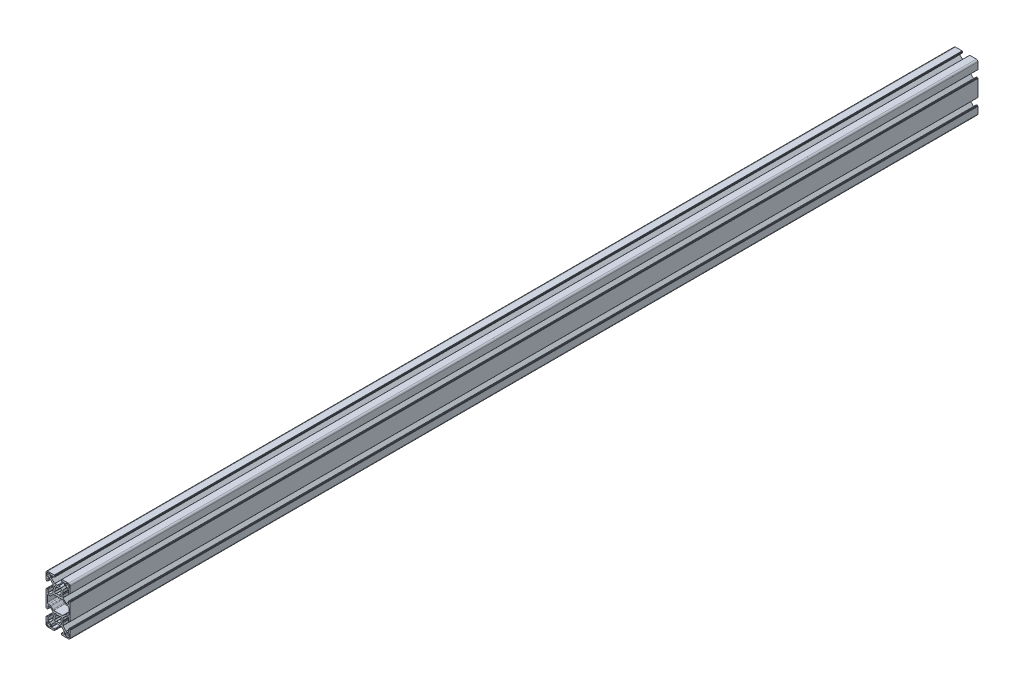
from build123d import *

# Parameters (mm, degrees)
EXTRUDE1_DEPTH = 1128.95


with BuildPart() as part:
    # Sketch1 → Extrude1 (new body)
    with BuildSketch(Plane.XY):
        with BuildLine():
            Line((4.117156145, -21), (0.899999648, -21))
            Line((0.899999648, -21), (0.101934004, -20.53923672))
            ThreePointArc((0.101934004, -20.53923672), (0, -20.511923593), (-0.101934004, -20.53923672))
            Line((-0.101934004, -20.53923672), (-0.899999648, -21))
            Line((-0.899999648, -21), (-4.117156145, -21))
            ThreePointArc((-4.117156145, -21), (-4.193692724, -21.015224069), (-4.258577305, -21.058578552))
            Line((-4.258577305, -21.058578552), (-8.191421308, -24.991421554))
            ThreePointArc((-8.191421308, -24.991421554), (-8.234775894, -25.056306263), (-8.25, -25.132843))
            Line((-8.25, -25.132843), (-8.25, -27.6))
            ThreePointArc((-8.25, -27.6), (-8.191421356, -27.741421356), (-8.05, -27.8))
            Line((-8.05, -27.8), (-4.65, -27.8))
            ThreePointArc((-4.65, -27.8), (-4.225735931, -27.975735931), (-4.05, -28.4))
            Line((-4.05, -28.4), (-4.05, -29.3))
            ThreePointArc((-4.05, -29.3), (-4.108578644, -29.441421356), (-4.25, -29.5))
            Line((-4.25, -29.5), (-4.35, -29.5))
            ThreePointArc((-4.35, -29.5), (-4.491421356, -29.558578644), (-4.55, -29.7))
            Line((-4.55, -29.7), (-4.55, -29.8))
            ThreePointArc((-4.55, -29.8), (-4.608578644, -29.941421356), (-4.75, -30))
            Line((-4.75, -30), (-13, -30))
            ThreePointArc((-13, -30), (-14.414213562, -29.414213562), (-15, -28))
            Line((-15, -28), (-15, -19.750000125))
            ThreePointArc((-15, -19.750000125), (-14.941421356, -19.608578769), (-14.8, -19.550000125))
            Line((-14.8, -19.550000125), (-14.700000334, -19.550000125))
            ThreePointArc((-14.700000334, -19.550000125), (-14.558578978, -19.491421481), (-14.500000334, -19.350000125))
            Line((-14.500000334, -19.350000125), (-14.500000334, -19.25))
            ThreePointArc((-14.500000334, -19.25), (-14.44142169, -19.108578644), (-14.300000334, -19.05))
            Line((-14.300000334, -19.05), (-13.400000821, -19.05))
            ThreePointArc((-13.400000821, -19.05), (-12.975736752, -19.225735931), (-12.800000821, -19.65))
            Line((-12.800000821, -19.65), (-12.800000821, -23.05))
            ThreePointArc((-12.800000821, -23.05), (-12.741422177, -23.191421356), (-12.600000821, -23.25))
            Line((-12.600000821, -23.25), (-10.132842821, -23.25))
            ThreePointArc((-10.132842821, -23.25), (-10.056306123, -23.234775902), (-9.991421447, -23.191421338))
            Line((-9.991421447, -23.191421338), (-6.063045884, -19.263044775))
            ThreePointArc((-6.063045884, -19.263044775), (-6.019691347, -19.198160112), (-6.004467258, -19.121623437))
            Line((-6.004467258, -19.121623437), (-6.004467258, -15.90000009))
            Line((-6.004467258, -15.90000009), (-5.542586948, -15.099999736))
            ThreePointArc((-5.542586948, -15.099999736), (-5.515792105, -15), (-5.542586948, -14.900000264))
            Line((-5.542586948, -14.900000264), (-6.004467258, -14.09999991))
            Line((-6.004467258, -14.09999991), (-6.004467258, -10.878376563))
            ThreePointArc((-6.004467258, -10.878376563), (-6.019691347, -10.801839888), (-6.063045884, -10.736955225))
            Line((-6.063045884, -10.736955225), (-9.991421447, -6.808578662))
            ThreePointArc((-9.991421447, -6.808578662), (-10.056306123, -6.765224098), (-10.132842821, -6.75))
            Line((-10.132842821, -6.75), (-12.600000821, -6.75))
            ThreePointArc((-12.600000821, -6.75), (-12.741422177, -6.808578644), (-12.800000821, -6.95))
            Line((-12.800000821, -6.95), (-12.800000821, -10.35))
            ThreePointArc((-12.800000821, -10.35), (-12.975736752, -10.774264069), (-13.400000821, -10.95))
            Line((-13.400000821, -10.95), (-14.300000334, -10.95))
            ThreePointArc((-14.300000334, -10.95), (-14.44142169, -10.891421356), (-14.500000334, -10.75))
            Line((-14.500000334, -10.75), (-14.500000334, -10.65))
            ThreePointArc((-14.500000334, -10.65), (-14.558578978, -10.508578644), (-14.700000334, -10.45))
            Line((-14.700000334, -10.45), (-14.8, -10.45))
            ThreePointArc((-14.8, -10.45), (-14.941421356, -10.391421356), (-15, -10.25))
            Line((-15, -10.25), (-15, 10.25))
            ThreePointArc((-15, 10.25), (-14.941421356, 10.391421356), (-14.8, 10.45))
            Line((-14.8, 10.45), (-14.700000334, 10.45))
            ThreePointArc((-14.700000334, 10.45), (-14.558578978, 10.508578644), (-14.500000334, 10.65))
            Line((-14.500000334, 10.65), (-14.500000334, 10.75))
            ThreePointArc((-14.500000334, 10.75), (-14.44142169, 10.891421356), (-14.300000334, 10.95))
            Line((-14.300000334, 10.95), (-13.400000821, 10.95))
            ThreePointArc((-13.400000821, 10.95), (-12.975736752, 10.774264069), (-12.800000821, 10.35))
            Line((-12.800000821, 10.35), (-12.800000821, 6.95))
            ThreePointArc((-12.800000821, 6.95), (-12.741422177, 6.808578644), (-12.600000821, 6.75))
            Line((-12.600000821, 6.75), (-10.132842821, 6.75))
            ThreePointArc((-10.132842821, 6.75), (-10.056306123, 6.765224098), (-9.991421447, 6.808578662))
            Line((-9.991421447, 6.808578662), (-6.063045884, 10.736955225))
            ThreePointArc((-6.063045884, 10.736955225), (-6.019691347, 10.801839888), (-6.004467258, 10.878376563))
            Line((-6.004467258, 10.878376563), (-6.004467258, 14.09999991))
            Line((-6.004467258, 14.09999991), (-5.542586948, 14.900000264))
            ThreePointArc((-5.542586948, 14.900000264), (-5.515792105, 15), (-5.542586948, 15.099999736))
            Line((-5.542586948, 15.099999736), (-6.004467258, 15.90000009))
            Line((-6.004467258, 15.90000009), (-6.004467258, 19.121623437))
            ThreePointArc((-6.004467258, 19.121623437), (-6.019691347, 19.198160112), (-6.063045884, 19.263044775))
            Line((-6.063045884, 19.263044775), (-9.991421447, 23.191421338))
            ThreePointArc((-9.991421447, 23.191421338), (-10.056306123, 23.234775902), (-10.132842821, 23.25))
            Line((-10.132842821, 23.25), (-12.600000821, 23.25))
            ThreePointArc((-12.600000821, 23.25), (-12.741422177, 23.191421356), (-12.800000821, 23.05))
            Line((-12.800000821, 23.05), (-12.800000821, 19.65))
            ThreePointArc((-12.800000821, 19.65), (-12.975736752, 19.225735931), (-13.400000821, 19.05))
            Line((-13.400000821, 19.05), (-14.300000334, 19.05))
            ThreePointArc((-14.300000334, 19.05), (-14.44142169, 19.108578644), (-14.500000334, 19.25))
            Line((-14.500000334, 19.25), (-14.500000334, 19.350000125))
            ThreePointArc((-14.500000334, 19.350000125), (-14.558578978, 19.491421481), (-14.700000334, 19.550000125))
            Line((-14.700000334, 19.550000125), (-14.8, 19.550000125))
            ThreePointArc((-14.8, 19.550000125), (-14.941421356, 19.608578769), (-15, 19.750000125))
            Line((-15, 19.750000125), (-15, 28))
            ThreePointArc((-15, 28), (-14.414213562, 29.414213562), (-13, 30))
            Line((-13, 30), (-4.75, 30))
            ThreePointArc((-4.75, 30), (-4.608578644, 29.941421356), (-4.55, 29.8))
            Line((-4.55, 29.8), (-4.55, 29.7))
            ThreePointArc((-4.55, 29.7), (-4.491421356, 29.558578644), (-4.35, 29.5))
            Line((-4.35, 29.5), (-4.25, 29.5))
            ThreePointArc((-4.25, 29.5), (-4.108578644, 29.441421356), (-4.05, 29.3))
            Line((-4.05, 29.3), (-4.05, 28.4))
            ThreePointArc((-4.05, 28.4), (-4.225735931, 27.975735931), (-4.65, 27.8))
            Line((-4.65, 27.8), (-8.05, 27.8))
            ThreePointArc((-8.05, 27.8), (-8.191421356, 27.741421356), (-8.25, 27.6))
            Line((-8.25, 27.6), (-8.25, 25.132843))
            ThreePointArc((-8.25, 25.132843), (-8.234775894, 25.056306263), (-8.191421308, 24.991421554))
            Line((-8.191421308, 24.991421554), (-4.258577305, 21.058578552))
            ThreePointArc((-4.258577305, 21.058578552), (-4.193692724, 21.015224069), (-4.117156145, 21))
            Line((-4.117156145, 21), (-0.899999648, 21))
            Line((-0.899999648, 21), (-0.101934004, 20.53923672))
            ThreePointArc((-0.101934004, 20.53923672), (0, 20.511923593), (0.101934004, 20.53923672))
            Line((0.101934004, 20.53923672), (0.899999648, 21))
            Line((0.899999648, 21), (4.117156145, 21))
            ThreePointArc((4.117156145, 21), (4.193692724, 21.015224069), (4.258577305, 21.058578552))
            Line((4.258577305, 21.058578552), (8.191421308, 24.991421554))
            ThreePointArc((8.191421308, 24.991421554), (8.234775894, 25.056306263), (8.25, 25.132843))
            Line((8.25, 25.132843), (8.25, 27.6))
            ThreePointArc((8.25, 27.6), (8.191421356, 27.741421356), (8.05, 27.8))
            Line((8.05, 27.8), (4.65, 27.8))
            ThreePointArc((4.65, 27.8), (4.225735931, 27.975735931), (4.05, 28.4))
            Line((4.05, 28.4), (4.05, 29.3))
            ThreePointArc((4.05, 29.3), (4.108578644, 29.441421356), (4.25, 29.5))
            Line((4.25, 29.5), (4.35, 29.5))
            ThreePointArc((4.35, 29.5), (4.491421356, 29.558578644), (4.55, 29.7))
            Line((4.55, 29.7), (4.55, 29.8))
            ThreePointArc((4.55, 29.8), (4.608578644, 29.941421356), (4.75, 30))
            Line((4.75, 30), (13, 30))
            ThreePointArc((13, 30), (14.414213562, 29.414213562), (15, 28))
            Line((15, 28), (15, 19.750000125))
            ThreePointArc((15, 19.750000125), (14.941421356, 19.608578769), (14.8, 19.550000125))
            Line((14.8, 19.550000125), (14.700000334, 19.550000125))
            ThreePointArc((14.700000334, 19.550000125), (14.558578978, 19.491421481), (14.500000334, 19.350000125))
            Line((14.500000334, 19.350000125), (14.500000334, 19.25))
            ThreePointArc((14.500000334, 19.25), (14.44142169, 19.108578644), (14.300000334, 19.05))
            Line((14.300000334, 19.05), (13.400000821, 19.05))
            ThreePointArc((13.400000821, 19.05), (12.975736752, 19.225735931), (12.800000821, 19.65))
            Line((12.800000821, 19.65), (12.800000821, 23.05))
            ThreePointArc((12.800000821, 23.05), (12.741422177, 23.191421356), (12.600000821, 23.25))
            Line((12.600000821, 23.25), (10.132842821, 23.25))
            ThreePointArc((10.132842821, 23.25), (10.056306123, 23.234775902), (9.991421447, 23.191421338))
            Line((9.991421447, 23.191421338), (6.063045884, 19.263044775))
            ThreePointArc((6.063045884, 19.263044775), (6.019691347, 19.198160112), (6.004467258, 19.121623437))
            Line((6.004467258, 19.121623437), (6.004467258, 15.90000009))
            Line((6.004467258, 15.90000009), (5.542586948, 15.099999736))
            ThreePointArc((5.542586948, 15.099999736), (5.515792105, 15), (5.542586948, 14.900000264))
            Line((5.542586948, 14.900000264), (6.004467258, 14.09999991))
            Line((6.004467258, 14.09999991), (6.004467258, 10.878376563))
            ThreePointArc((6.004467258, 10.878376563), (6.019691347, 10.801839888), (6.063045884, 10.736955225))
            Line((6.063045884, 10.736955225), (9.991421447, 6.808578662))
            ThreePointArc((9.991421447, 6.808578662), (10.056306123, 6.765224098), (10.132842821, 6.75))
            Line((10.132842821, 6.75), (12.600000821, 6.75))
            ThreePointArc((12.600000821, 6.75), (12.741422177, 6.808578644), (12.800000821, 6.95))
            Line((12.800000821, 6.95), (12.800000821, 10.35))
            ThreePointArc((12.800000821, 10.35), (12.975736752, 10.774264069), (13.400000821, 10.95))
            Line((13.400000821, 10.95), (14.300000334, 10.95))
            ThreePointArc((14.300000334, 10.95), (14.44142169, 10.891421356), (14.500000334, 10.75))
            Line((14.500000334, 10.75), (14.500000334, 10.65))
            ThreePointArc((14.500000334, 10.65), (14.558578978, 10.508578644), (14.700000334, 10.45))
            Line((14.700000334, 10.45), (14.8, 10.45))
            ThreePointArc((14.8, 10.45), (14.941421356, 10.391421356), (15, 10.25))
            Line((15, 10.25), (15, -10.25))
            ThreePointArc((15, -10.25), (14.941421356, -10.391421356), (14.8, -10.45))
            Line((14.8, -10.45), (14.700000334, -10.45))
            ThreePointArc((14.700000334, -10.45), (14.558578978, -10.508578644), (14.500000334, -10.65))
            Line((14.500000334, -10.65), (14.500000334, -10.75))
            ThreePointArc((14.500000334, -10.75), (14.44142169, -10.891421356), (14.300000334, -10.95))
            Line((14.300000334, -10.95), (13.400000821, -10.95))
            ThreePointArc((13.400000821, -10.95), (12.975736752, -10.774264069), (12.800000821, -10.35))
            Line((12.800000821, -10.35), (12.800000821, -6.95))
            ThreePointArc((12.800000821, -6.95), (12.741422177, -6.808578644), (12.600000821, -6.75))
            Line((12.600000821, -6.75), (10.132842821, -6.75))
            ThreePointArc((10.132842821, -6.75), (10.056306123, -6.765224098), (9.991421447, -6.808578662))
            Line((9.991421447, -6.808578662), (6.063045884, -10.736955225))
            ThreePointArc((6.063045884, -10.736955225), (6.019691347, -10.801839888), (6.004467258, -10.878376563))
            Line((6.004467258, -10.878376563), (6.004467258, -14.09999991))
            Line((6.004467258, -14.09999991), (5.542586948, -14.900000264))
            ThreePointArc((5.542586948, -14.900000264), (5.515792105, -15), (5.542586948, -15.099999736))
            Line((5.542586948, -15.099999736), (6.004467258, -15.90000009))
            Line((6.004467258, -15.90000009), (6.004467258, -19.121623437))
            ThreePointArc((6.004467258, -19.121623437), (6.019691347, -19.198160112), (6.063045884, -19.263044775))
            Line((6.063045884, -19.263044775), (9.991421447, -23.191421338))
            ThreePointArc((9.991421447, -23.191421338), (10.056306123, -23.234775902), (10.132842821, -23.25))
            Line((10.132842821, -23.25), (12.600000821, -23.25))
            ThreePointArc((12.600000821, -23.25), (12.741422177, -23.191421356), (12.800000821, -23.05))
            Line((12.800000821, -23.05), (12.800000821, -19.65))
            ThreePointArc((12.800000821, -19.65), (12.975736752, -19.225735931), (13.400000821, -19.05))
            Line((13.400000821, -19.05), (14.300000334, -19.05))
            ThreePointArc((14.300000334, -19.05), (14.44142169, -19.108578644), (14.500000334, -19.25))
            Line((14.500000334, -19.25), (14.500000334, -19.350000125))
            ThreePointArc((14.500000334, -19.350000125), (14.558578978, -19.491421481), (14.700000334, -19.550000125))
            Line((14.700000334, -19.550000125), (14.8, -19.550000125))
            ThreePointArc((14.8, -19.550000125), (14.941421356, -19.608578769), (15, -19.750000125))
            Line((15, -19.750000125), (15, -28))
            ThreePointArc((15, -28), (14.414213562, -29.414213562), (13, -30))
            Line((13, -30), (4.75, -30))
            ThreePointArc((4.75, -30), (4.608578644, -29.941421356), (4.55, -29.8))
            Line((4.55, -29.8), (4.55, -29.7))
            ThreePointArc((4.55, -29.7), (4.491421356, -29.558578644), (4.35, -29.5))
            Line((4.35, -29.5), (4.25, -29.5))
            ThreePointArc((4.25, -29.5), (4.108578644, -29.441421356), (4.05, -29.3))
            Line((4.05, -29.3), (4.05, -28.4))
            ThreePointArc((4.05, -28.4), (4.225735931, -27.975735931), (4.65, -27.8))
            Line((4.65, -27.8), (8.05, -27.8))
            ThreePointArc((8.05, -27.8), (8.191421356, -27.741421356), (8.25, -27.6))
            Line((8.25, -27.6), (8.25, -25.132843))
            ThreePointArc((8.25, -25.132843), (8.234775894, -25.056306263), (8.191421308, -24.991421554))
            Line((8.191421308, -24.991421554), (4.258577305, -21.058578552))
            ThreePointArc((4.258577305, -21.058578552), (4.193692724, -21.015224069), (4.117156145, -21))
        make_face()
        with BuildLine():
            Line((1.600130621, -18.280561232), (3.154670945, -19.505335862))
            ThreePointArc((3.154670945, -19.505335862), (3.897156783, -18.881001031), (4.518401855, -18.135928041))
            Line((4.518401855, -18.135928041), (3.28056155, -16.600129968))
            ThreePointArc((3.28056155, -16.600129968), (3.65, -15), (3.28056155, -13.399870032))
            Line((3.28056155, -13.399870032), (4.518401855, -11.864071959))
            ThreePointArc((4.518401855, -11.864071959), (3.897156783, -11.118998969), (3.154670945, -10.494664138))
            Line((3.154670945, -10.494664138), (1.600130621, -11.719438768))
            ThreePointArc((1.600130621, -11.719438768), (0, -11.35), (-1.600130621, -11.719438768))
            Line((-1.600130621, -11.719438768), (-3.154670945, -10.494664138))
            ThreePointArc((-3.154670945, -10.494664138), (-3.897156783, -11.118998969), (-4.518401855, -11.864071959))
            Line((-4.518401855, -11.864071959), (-3.28056155, -13.399870032))
            ThreePointArc((-3.28056155, -13.399870032), (-3.65, -15), (-3.28056155, -16.600129968))
            Line((-3.28056155, -16.600129968), (-4.518401855, -18.135928041))
            ThreePointArc((-4.518401855, -18.135928041), (-3.897156783, -18.881001031), (-3.154670945, -19.505335862))
            Line((-3.154670945, -19.505335862), (-1.600130621, -18.280561232))
            ThreePointArc((-1.600130621, -18.280561232), (0, -18.65), (1.600130621, -18.280561232))
        make_face(mode=Mode.SUBTRACT)
        with BuildLine():
            Line((10.500000904, -24.500000174), (12.700000904, -24.500000174))
            ThreePointArc((12.700000904, -24.500000174), (13.407107685, -24.792893393), (13.700000904, -25.500000174))
            Line((13.700000904, -25.500000174), (13.700000904, -27.700000174))
            ThreePointArc((13.700000904, -27.700000174), (13.407107685, -28.407106955), (12.700000904, -28.700000174))
            Line((12.700000904, -28.700000174), (10.500000904, -28.700000174))
            ThreePointArc((10.500000904, -28.700000174), (9.792894123, -28.407106955), (9.500000904, -27.700000174))
            Line((9.500000904, -27.700000174), (9.500000904, -25.500000174))
            ThreePointArc((9.500000904, -25.500000174), (9.792894123, -24.792893393), (10.500000904, -24.500000174))
        make_face(mode=Mode.SUBTRACT)
        with BuildLine():
            Line((8.927207818, -5.539339793), (6.410354008, -8.056193946))
            ThreePointArc((6.410354008, -8.056193946), (5.923718991, -8.381353081), (5.349693844, -8.495533793))
            Line((5.349693844, -8.495533793), (-5.349693844, -8.495533793))
            ThreePointArc((-5.349693844, -8.495533793), (-5.923718991, -8.381353081), (-6.410354008, -8.056193946))
            Line((-6.410354008, -8.056193946), (-8.927207818, -5.539339793))
            ThreePointArc((-8.927207818, -5.539339793), (-9.413842802, -5.214180692), (-9.987867904, -5.1))
            Line((-9.987867904, -5.1), (-11.849999904, -5.1))
            ThreePointArc((-11.849999904, -5.1), (-12.910660076, -4.660660172), (-13.349999904, -3.6))
            Line((-13.349999904, -3.6), (-13.349999904, 3.6))
            ThreePointArc((-13.349999904, 3.6), (-12.910660076, 4.660660172), (-11.849999904, 5.1))
            Line((-11.849999904, 5.1), (-9.987867904, 5.1))
            ThreePointArc((-9.987867904, 5.1), (-9.413842802, 5.214180692), (-8.927207818, 5.539339793))
            Line((-8.927207818, 5.539339793), (-6.410354008, 8.056193946))
            ThreePointArc((-6.410354008, 8.056193946), (-5.923718991, 8.381353081), (-5.349693844, 8.495533793))
            Line((-5.349693844, 8.495533793), (5.349693844, 8.495533793))
            ThreePointArc((5.349693844, 8.495533793), (5.923718991, 8.381353081), (6.410354008, 8.056193946))
            Line((6.410354008, 8.056193946), (8.927207818, 5.539339793))
            ThreePointArc((8.927207818, 5.539339793), (9.413842802, 5.214180692), (9.987867904, 5.1))
            Line((9.987867904, 5.1), (11.849999904, 5.1))
            ThreePointArc((11.849999904, 5.1), (12.910660076, 4.660660172), (13.349999904, 3.6))
            Line((13.349999904, 3.6), (13.349999904, -3.6))
            ThreePointArc((13.349999904, -3.6), (12.910660076, -4.660660172), (11.849999904, -5.1))
            Line((11.849999904, -5.1), (9.987867904, -5.1))
            ThreePointArc((9.987867904, -5.1), (9.413842802, -5.214180692), (8.927207818, -5.539339793))
        make_face(mode=Mode.SUBTRACT)
        with BuildLine():
            Line((-1.600130621, 18.280561232), (-3.154670945, 19.505335862))
            ThreePointArc((-3.154670945, 19.505335862), (-3.897156783, 18.881001031), (-4.518401855, 18.135928041))
            Line((-4.518401855, 18.135928041), (-3.28056155, 16.600129968))
            ThreePointArc((-3.28056155, 16.600129968), (-3.65, 15), (-3.28056155, 13.399870032))
            Line((-3.28056155, 13.399870032), (-4.518401855, 11.864071959))
            ThreePointArc((-4.518401855, 11.864071959), (-3.897156783, 11.118998969), (-3.154670945, 10.494664138))
            Line((-3.154670945, 10.494664138), (-1.600130621, 11.719438768))
            ThreePointArc((-1.600130621, 11.719438768), (0, 11.35), (1.600130621, 11.719438768))
            Line((1.600130621, 11.719438768), (3.154670945, 10.494664138))
            ThreePointArc((3.154670945, 10.494664138), (3.897156783, 11.118998969), (4.518401855, 11.864071959))
            Line((4.518401855, 11.864071959), (3.28056155, 13.399870032))
            ThreePointArc((3.28056155, 13.399870032), (3.65, 15), (3.28056155, 16.600129968))
            Line((3.28056155, 16.600129968), (4.518401855, 18.135928041))
            ThreePointArc((4.518401855, 18.135928041), (3.897156783, 18.881001031), (3.154670945, 19.505335862))
            Line((3.154670945, 19.505335862), (1.600130621, 18.280561232))
            ThreePointArc((1.600130621, 18.280561232), (0, 18.65), (-1.600130621, 18.280561232))
        make_face(mode=Mode.SUBTRACT)
        with BuildLine():
            Line((-10.500000904, 24.500000174), (-12.700000904, 24.500000174))
            ThreePointArc((-12.700000904, 24.500000174), (-13.407107685, 24.792893393), (-13.700000904, 25.500000174))
            Line((-13.700000904, 25.500000174), (-13.700000904, 27.700000174))
            ThreePointArc((-13.700000904, 27.700000174), (-13.407107685, 28.407106955), (-12.700000904, 28.700000174))
            Line((-12.700000904, 28.700000174), (-10.500000904, 28.700000174))
            ThreePointArc((-10.500000904, 28.700000174), (-9.792894123, 28.407106955), (-9.500000904, 27.700000174))
            Line((-9.500000904, 27.700000174), (-9.500000904, 25.500000174))
            ThreePointArc((-9.500000904, 25.500000174), (-9.792894123, 24.792893393), (-10.500000904, 24.500000174))
        make_face(mode=Mode.SUBTRACT)
        with BuildLine():
            Line((9.500000904, 27.700000174), (9.500000904, 25.500000174))
            ThreePointArc((9.500000904, 25.500000174), (9.792894123, 24.792893393), (10.500000904, 24.500000174))
            Line((10.500000904, 24.500000174), (12.700000904, 24.500000174))
            ThreePointArc((12.700000904, 24.500000174), (13.407107685, 24.792893393), (13.700000904, 25.500000174))
            Line((13.700000904, 25.500000174), (13.700000904, 27.700000174))
            ThreePointArc((13.700000904, 27.700000174), (13.407107685, 28.407106955), (12.700000904, 28.700000174))
            Line((12.700000904, 28.700000174), (10.500000904, 28.700000174))
            ThreePointArc((10.500000904, 28.700000174), (9.792894123, 28.407106955), (9.500000904, 27.700000174))
        make_face(mode=Mode.SUBTRACT)
        with BuildLine():
            Line((-9.500000904, -27.700000174), (-9.500000904, -25.500000174))
            ThreePointArc((-9.500000904, -25.500000174), (-9.792894123, -24.792893393), (-10.500000904, -24.500000174))
            Line((-10.500000904, -24.500000174), (-12.700000904, -24.500000174))
            ThreePointArc((-12.700000904, -24.500000174), (-13.407107685, -24.792893393), (-13.700000904, -25.500000174))
            Line((-13.700000904, -25.500000174), (-13.700000904, -27.700000174))
            ThreePointArc((-13.700000904, -27.700000174), (-13.407107685, -28.407106955), (-12.700000904, -28.700000174))
            Line((-12.700000904, -28.700000174), (-10.500000904, -28.700000174))
            ThreePointArc((-10.500000904, -28.700000174), (-9.792894123, -28.407106955), (-9.500000904, -27.700000174))
        make_face(mode=Mode.SUBTRACT)
    extrude(amount=EXTRUDE1_DEPTH)


solid = part.part
